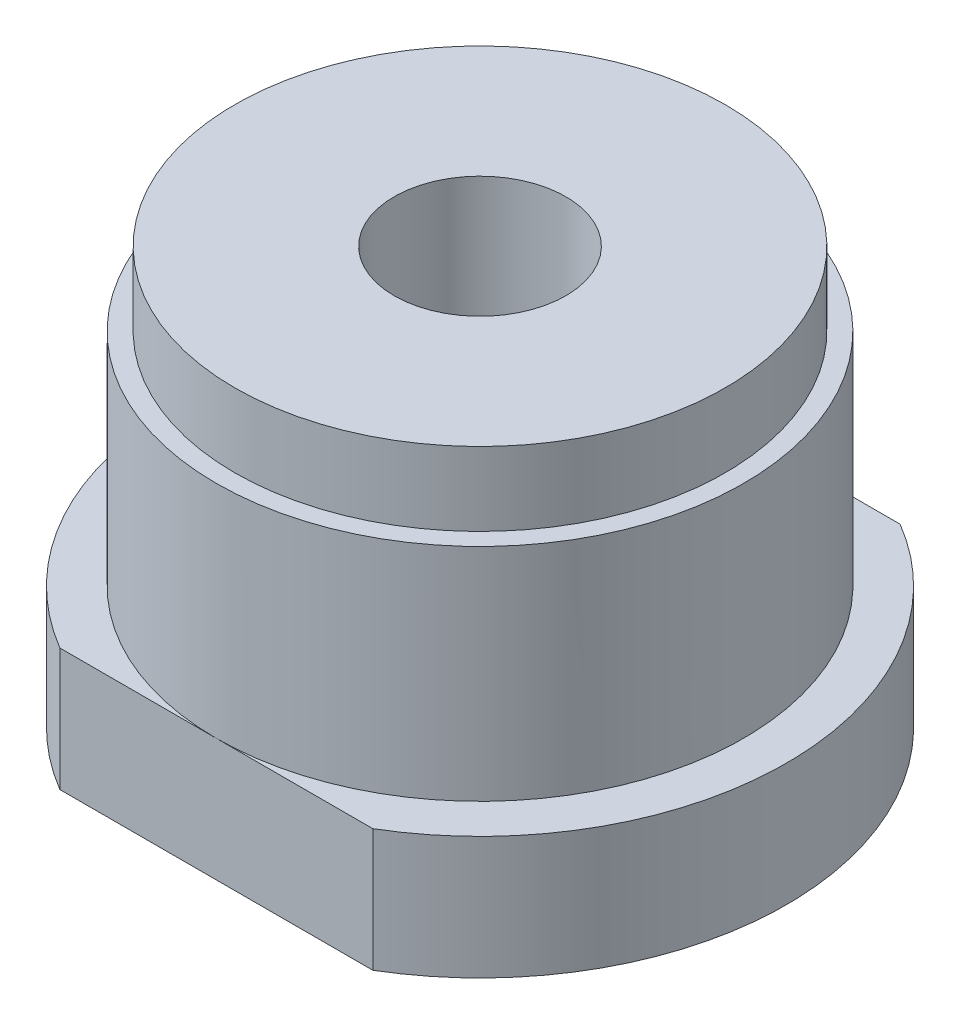
from build123d import *

# Parameters (mm, degrees)
SKETCH1_R           = 12.5
BOSS_EXTRUDE1_DEPTH = 17
SKETCH2_R           = 3.5
CUT_EXTRUDE1_DEPTH  = 15
SKETCH4_OUTSIDE_W   = 34.846
SKETCH4_OUTSIDE_H   = 34.846
SKETCH4_OUTSIDE_R   = 10
CUT_EXTRUDE3_DEPTH  = 12
SKETCH5_R           = 1.25
CUT_EXTRUDE4_DEPTH  = 10
SKETCH8_R           = 10.75
SKETCH8_R_2         = 4
BOSS_EXTRUDE3_DEPTH = 9
SKETCH7_W           = 22.925756412
SKETCH7_H           = 4.884412095
CUT_EXTRUDE6_DEPTH  = 22.365860619


with BuildPart() as part:
    # Sketch1 → Boss-Extrude1 (new body)
    with BuildSketch(Plane(origin=(0, 0, 0), x_dir=(1, 0, 0), z_dir=(0, 1, 0))):
        with Locations(Location((0, 0, 0), (0, 0, 270))):
            Circle(SKETCH1_R)
    extrude(amount=BOSS_EXTRUDE1_DEPTH)

    # Sketch2 → Cut-Extrude1 (cut)
    with BuildSketch(Plane(origin=(0, 17, 0), x_dir=(1, 0, 0), z_dir=(0, 1, 0))):
        with Locations(Location((0, 0, 0), (0, 0, 270))):
            Circle(SKETCH2_R)
    extrude(amount=-CUT_EXTRUDE1_DEPTH, mode=Mode.SUBTRACT)

    # Sketch4 outside → Cut-Extrude3 (cut)
    with BuildSketch(Plane(origin=(0, 17, 0), x_dir=(1, 0, 0), z_dir=(0, 1, 0))):
        Rectangle(SKETCH4_OUTSIDE_W, SKETCH4_OUTSIDE_H)
        with Locations(Location((0, 0, 0), (0, 0, 270))):
            Circle(SKETCH4_OUTSIDE_R, mode=Mode.SUBTRACT)
    extrude(amount=-CUT_EXTRUDE3_DEPTH, mode=Mode.SUBTRACT)

    # Sketch5 → Cut-Extrude4 (cut)
    with BuildSketch(Plane.XZ):
        with Locations(Location((-8, 0, 0), (0, 0, 270))):
            Circle(SKETCH5_R)
    cut_extrude4 = extrude(amount=-CUT_EXTRUDE4_DEPTH, mode=Mode.SUBTRACT)

    # Mirror2: Cut-Extrude4 across plane
    add(cut_extrude4.mirror(Plane(origin=(0, 0, 0), x_dir=(0, 0, 1), z_dir=(1, 0, 0))), mode=Mode.SUBTRACT)

    # Sketch8 → Boss-Extrude3 (add)
    with BuildSketch(Plane(origin=(0, 5, 0), x_dir=(1, 0, 0), z_dir=(0, 1, 0))):
        with Locations(Location((0, 0, 0), (0, 0, 270))):
            Circle(SKETCH8_R)
        Circle(SKETCH8_R_2, mode=Mode.SUBTRACT)
    extrude(amount=BOSS_EXTRUDE3_DEPTH)

    # Sketch7 → Cut-Extrude6 (cut, through all)
    with BuildSketch(Plane(origin=(0, 5, 0), x_dir=(1, 0, 0), z_dir=(0, 1, 0))):
        with Locations((0.376120232, 13.192206048)):
            Rectangle(SKETCH7_W, SKETCH7_H)
    cut_extrude6 = extrude(amount=-CUT_EXTRUDE6_DEPTH, mode=Mode.SUBTRACT)

    # Mirror3: Cut-Extrude6 across plane
    add(cut_extrude6.mirror(Plane.XY), mode=Mode.SUBTRACT)


solid = part.part
